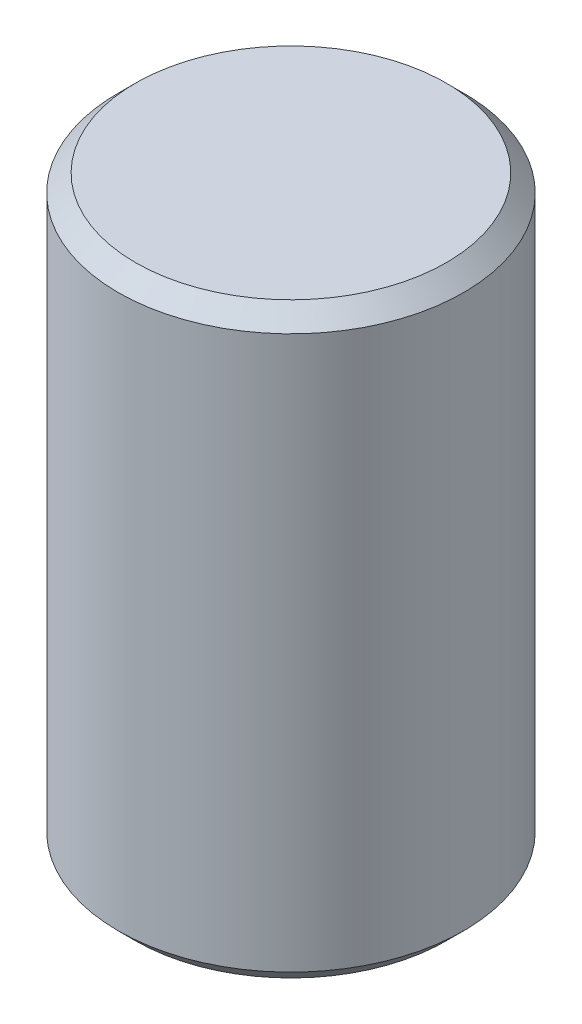
from build123d import *

# Parameters (mm, degrees)
SKETCH1_R           = 5
BOSS_EXTRUDE1_DEPTH = 8.5
CHAMFER1_SIZE       = 0.5


with BuildPart() as part:
    # Sketch1 → Boss-Extrude1 (new, symmetric)
    with BuildSketch(Plane(origin=(0, 0, 0), x_dir=(1, 0, 0), z_dir=(0, 1, 0))):
        with Locations(Location((0, 0, 0), (0, 0, 270))):
            Circle(SKETCH1_R)
    extrude(amount=BOSS_EXTRUDE1_DEPTH, both=True)

    # Chamfer1
    chamfer1_edges = [part.edges().sort_by_distance(p)[0] for p in [
        (0, -8.5, -5),
        (0, 8.5, -5),
    ]]
    chamfer(chamfer1_edges, length=CHAMFER1_SIZE)


solid = part.part
